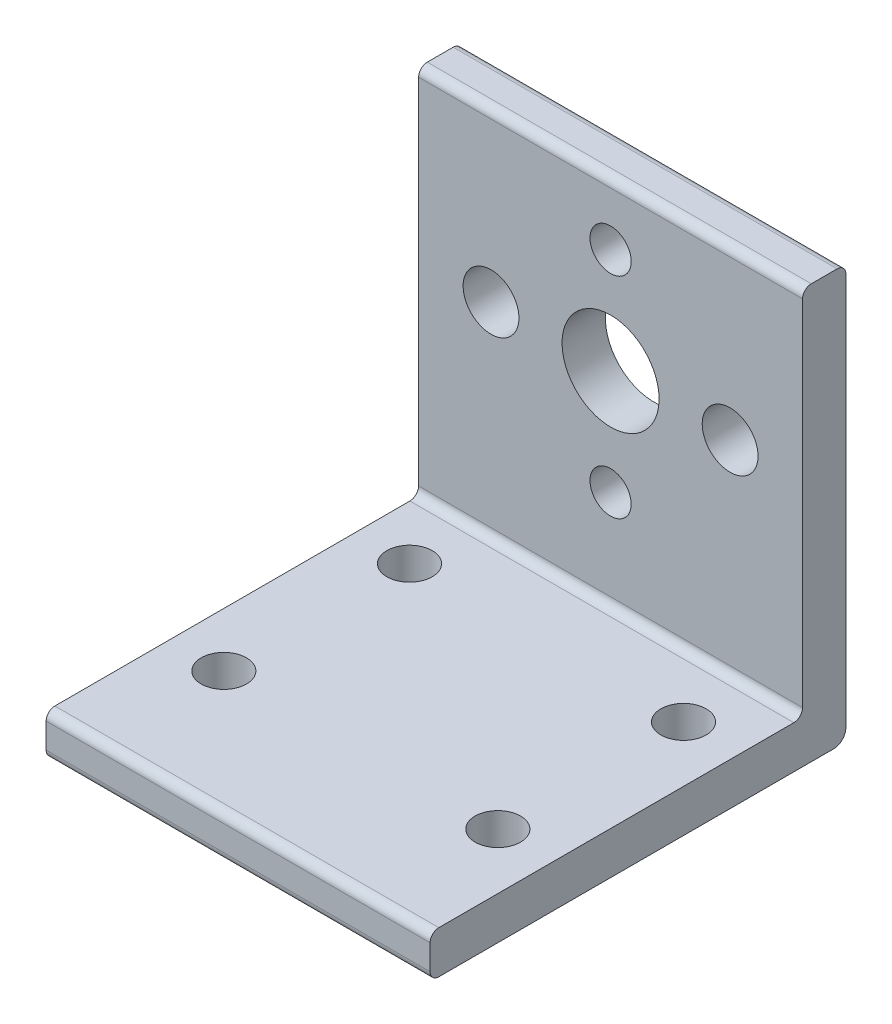
from build123d import *

# Parameters (mm, degrees)
BOSS_EXTRUDE1_DEPTH     = 27.94
SKETCH2_R               = 3.5306
SKETCH2_R_2             = 1.4986
SKETCH2_R_3             = 2.032
MOTOR_MOUNT_HOLES_DEPTH = 52.022252766
SKETCH3_R               = 1.651
PLATE_MOUNT_HOLES_DEPTH = 52.022252766
FILLET1_R               = 0.635
FILLET2_R               = 0.889
FILLET3_R               = 0.635


with BuildPart() as part:
    # Sketch1 → Boss-Extrude1 (new body)
    with BuildSketch(Plane(origin=(0, 0, 0), x_dir=(0, 0, -1), z_dir=(1, 0, 0))):
        Polygon((0, 0), (0, -30.1244), (-30.2514, -30.1244), (-30.2514, -27.0256), (-3.1496, -27.0256), (-3.1496, 0), align=None)
    extrude(amount=BOSS_EXTRUDE1_DEPTH)

    # Sketch2 → Motor_Mount_holes (cut, through all)
    with BuildSketch(Plane.XY):
        with Locations(Location((13.97, -12.1666, 0), (0, 0, 90))):
            Circle(SKETCH2_R)
        with Locations(Location((13.97, -4.5212, 0), (0, 0, 90))):
            Circle(SKETCH2_R_2)
        with Locations(Location((5.2705, -12.1666, 0), (0, 0, 90))):
            Circle(SKETCH2_R_3)
        with Locations(Location((22.6695, -12.1666, 0), (0, 0, 180))):
            Circle(SKETCH2_R_3)
        with Locations(Location((13.97, -19.812, 0), (0, 0, 180))):
            Circle(SKETCH2_R_2)
    extrude(amount=MOTOR_MOUNT_HOLES_DEPTH, mode=Mode.SUBTRACT)

    # Sketch3 → Plate_Mount_Holes (cut, through all)
    with BuildSketch(Plane(origin=(0, -30.1244, 0), x_dir=(1, 0, 0), z_dir=(0, 1, 0))):
        with Locations(Location((3.937, -7.747, 0), (0, 0, 90))):
            Circle(SKETCH3_R)
        with Locations(Location((23.876, -7.747, 0), (0, 0, 90))):
            Circle(SKETCH3_R)
        with Locations(Location((3.937, -21.2598, 0), (0, 0, 90))):
            Circle(SKETCH3_R)
        with Locations(Location((23.876, -21.2598, 0), (0, 0, 90))):
            Circle(SKETCH3_R)
    extrude(amount=PLATE_MOUNT_HOLES_DEPTH, mode=Mode.SUBTRACT)

    # Fillet1
    fillet1_edges = [part.edges().sort_by_distance(p)[0] for p in [
        (13.97, -27.0256, 3.1496),
    ]]
    fillet(fillet1_edges, radius=FILLET1_R)

    # Fillet2
    fillet2_edges = [part.edges().sort_by_distance(p)[0] for p in [
        (13.97, -30.1244, 0),
    ]]
    fillet(fillet2_edges, radius=FILLET2_R)

    # Fillet3
    fillet3_edges = [part.edges().sort_by_distance(p)[0] for p in [
        (13.97, 0, 0),
        (13.97, -30.1244, 30.2514),
        (13.97, -27.0256, 30.2514),
        (13.97, 0, 3.1496),
    ]]
    fillet(fillet3_edges, radius=FILLET3_R)


solid = part.part
